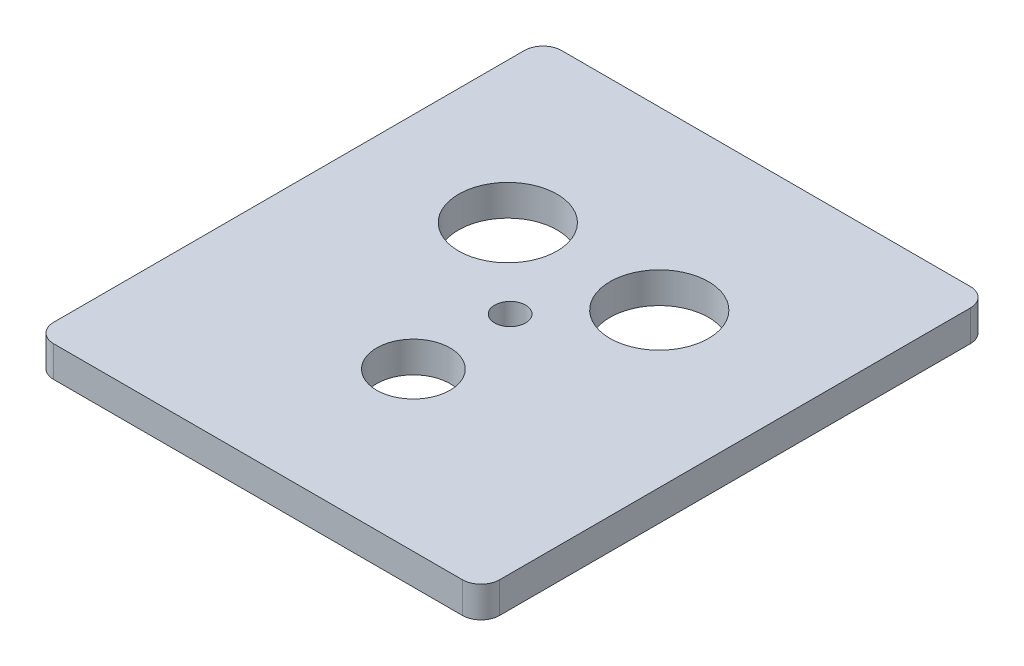
from build123d import *

# Parameters (mm, degrees)
BOSS_EXTRUDE1_DEPTH = 5
SKETCH2_R           = 7.95
CUT_EXTRUDE3_DEPTH  = 5
SKETCH4_R           = 2.5
SKETCH4_R_2         = 5.925
CUT_EXTRUDE4_DEPTH  = 5


with BuildPart() as part:
    # Sketch1 → Boss-Extrude1 (new body)
    with BuildSketch(Plane(origin=(0, 0, 0), x_dir=(1, 0, 0), z_dir=(0, 1, 0))):
        with BuildLine():
            Line((-34.721115538, 28.398406375), (31.278884462, 28.398406375))
            ThreePointArc((31.278884462, 28.398406375), (33.400204806, 27.519726718), (34.278884462, 25.398406375))
            Line((34.278884462, 25.398406375), (34.278884462, -50.601593625))
            ThreePointArc((34.278884462, -50.601593625), (33.400204806, -52.722913969), (31.278884462, -53.601593625))
            Line((31.278884462, -53.601593625), (-34.721115538, -53.601593625))
            ThreePointArc((-34.721115538, -53.601593625), (-36.842435881, -52.722913969), (-37.721115538, -50.601593625))
            Line((-37.721115538, -50.601593625), (-37.721115538, 25.398406375))
            ThreePointArc((-37.721115538, 25.398406375), (-36.842435881, 27.519726718), (-34.721115538, 28.398406375))
        make_face()
    extrude(amount=BOSS_EXTRUDE1_DEPTH)

    # Sketch2 → Cut-Extrude3 (cut)
    with BuildSketch(Plane(origin=(0, 5, 0), x_dir=(1, 0, 0), z_dir=(0, 1, 0))):
        with Locations(Location((-14.996537264, 0, 0), (0, 0, 270))):
            Circle(SKETCH2_R)
        with Locations(Location((9.453462736, 0, 0), (0, 0, 270))):
            Circle(SKETCH2_R)
    extrude(amount=-CUT_EXTRUDE3_DEPTH, mode=Mode.SUBTRACT)

    # Sketch4 → Cut-Extrude4 (cut)
    with BuildSketch(Plane(origin=(0, 5, 0), x_dir=(1, 0, 0), z_dir=(0, 1, 0))):
        with Locations(Location((-2.024594695, -12.601593625, 0), (0, 0, 270))):
            Circle(SKETCH4_R)
        with Locations(Location((-2.139356247, -28.105866385, 0), (0, 0, 270))):
            Circle(SKETCH4_R_2)
    extrude(amount=-CUT_EXTRUDE4_DEPTH, mode=Mode.SUBTRACT)


solid = part.part
